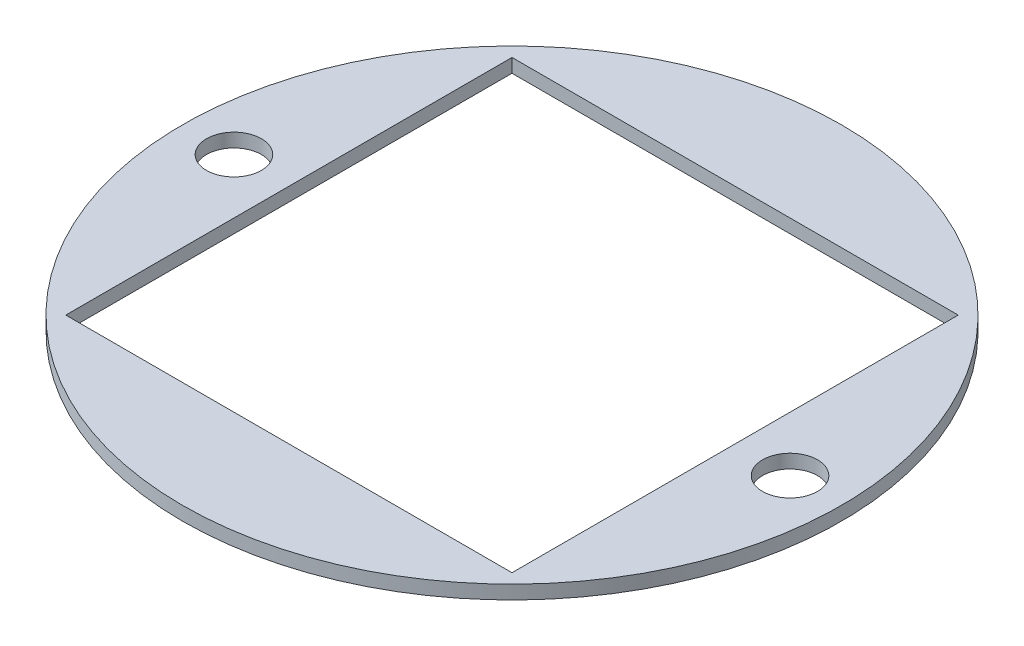
from build123d import *

# Parameters (mm, degrees)
SKETCH1_R           = 76.2
BOSS_EXTRUDE1_DEPTH = 3.175
SKETCH2_R           = 35
CUT_EXTRUDE1_DEPTH  = 3.175
SKETCH3_R           = 6.35
CUT_EXTRUDE2_DEPTH  = 10
SKETCH5_W           = 100
SKETCH5_H           = 100
CUT_EXTRUDE3_DEPTH  = 10
FILLET1_R           = 0.5
SKETCH6_W           = 103.175
SKETCH6_H           = 103.175
CUT_EXTRUDE4_DEPTH  = 10


with BuildPart() as part:
    # Sketch1 → Boss-Extrude1 (new body)
    with BuildSketch(Plane(origin=(0, 0, 0), x_dir=(1, 0, 0), z_dir=(0, 1, 0))):
        with Locations(Location((0, 0, 0), (0, 0, 270))):
            Circle(SKETCH1_R)
    extrude(amount=BOSS_EXTRUDE1_DEPTH)

    # Sketch2 → Cut-Extrude1 (cut)
    with BuildSketch(Plane(origin=(0, 3.175, 0), x_dir=(1, 0, 0), z_dir=(0, 1, 0))):
        with Locations(Location((0, 0, 0), (0, 0, 270))):
            Circle(SKETCH2_R)
    extrude(amount=-CUT_EXTRUDE1_DEPTH, mode=Mode.SUBTRACT)

    # Sketch3 → Cut-Extrude2 (cut)
    with BuildSketch(Plane(origin=(0, 3.175, 0), x_dir=(1, 0, 0), z_dir=(0, 1, 0))):
        with Locations(Location((-64.2875, 0, 0), (0, 0, 270))):
            Circle(SKETCH3_R)
        with Locations(Location((64.2875, 0, 0), (0, 0, 270))):
            Circle(SKETCH3_R)
    extrude(amount=-CUT_EXTRUDE2_DEPTH, mode=Mode.SUBTRACT)

    # Sketch5 → Cut-Extrude3 (cut)
    with BuildSketch(Plane(origin=(0, 3.175, 0), x_dir=(1, 0, 0), z_dir=(0, 1, 0))):
        Rectangle(SKETCH5_W, SKETCH5_H)
    extrude(amount=-CUT_EXTRUDE3_DEPTH, mode=Mode.SUBTRACT)

    # Fillet1
    fillet1_edges = [part.edges().sort_by_distance(p)[0] for p in [
        (-50, 1.5875, 50),
        (-50, 1.5875, -50),
        (50, 1.5875, -50),
        (50, 1.5875, 50),
    ]]
    fillet(fillet1_edges, radius=FILLET1_R)

    # Sketch6 → Cut-Extrude4 (cut)
    with BuildSketch(Plane(origin=(0, 3.175, 0), x_dir=(1, 0, 0), z_dir=(0, 1, 0))):
        Rectangle(SKETCH6_W, SKETCH6_H)
    extrude(amount=-CUT_EXTRUDE4_DEPTH, mode=Mode.SUBTRACT)


solid = part.part
